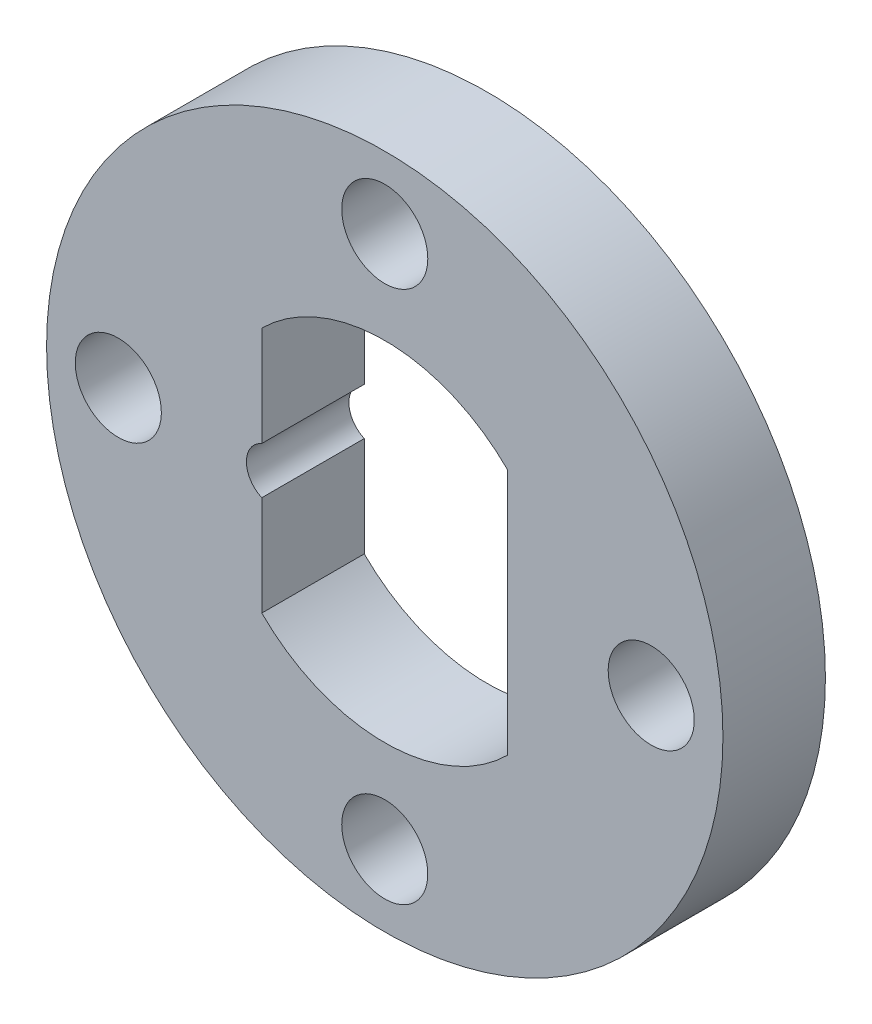
from build123d import *

# Parameters (mm, degrees)
ESQUISSE1_R                  = 16.5
EXTRUSION1_DEPTH             = 5
ESQUISSE2_R                  = 2.1
ENL_V_MAT_EXTRU_1_DEPTH      = 24.864199128
R_P_TITION_CIRCULAIRE1_COUNT = 4
ESQUISSE3_R                  = 1.25
ENL_V_MAT_EXTRU_2_DEPTH      = 24.864199128


with BuildPart() as part:
    # Esquisse1 → Extrusion1 (new body)
    with BuildSketch(Plane.XY):
        Circle(ESQUISSE1_R)
        with BuildLine():
            Line((-6, 6.020797289), (-6, -6.020797289))
            ThreePointArc((-6, -6.020797289), (0, -8.5), (6, -6.020797289))
            Line((6, -6.020797289), (6, 6.020797289))
            ThreePointArc((6, 6.020797289), (0, 8.5), (-6, 6.020797289))
        make_face(mode=Mode.SUBTRACT)
    extrude(amount=EXTRUSION1_DEPTH)

    # Esquisse2 → Enlèv. mat.-Extru.1 (cut, through all)
    with BuildSketch(Plane.XY.offset(5)):
        with Locations((0, 13)):
            Circle(ESQUISSE2_R)
    enl_v_mat_extru_1 = extrude(amount=-ENL_V_MAT_EXTRU_1_DEPTH, mode=Mode.SUBTRACT)

    # Répétition circulaire1: Enlèv. mat.-Extru.1 ×4 about axis
    r_p_tition_circulaire1_axis = Axis((0, 0, 5), (0, 0, -1))
    for i in range(1, R_P_TITION_CIRCULAIRE1_COUNT):
        add(enl_v_mat_extru_1.rotate(r_p_tition_circulaire1_axis, i * 360 / R_P_TITION_CIRCULAIRE1_COUNT), mode=Mode.SUBTRACT)

    # Esquisse3 → Enlèv. mat.-Extru.2 (cut, through all)
    with BuildSketch(Plane.XY.offset(5)):
        with Locations((-5.5, 0)):
            Circle(ESQUISSE3_R)
    extrude(amount=-ENL_V_MAT_EXTRU_2_DEPTH, mode=Mode.SUBTRACT)


solid = part.part
